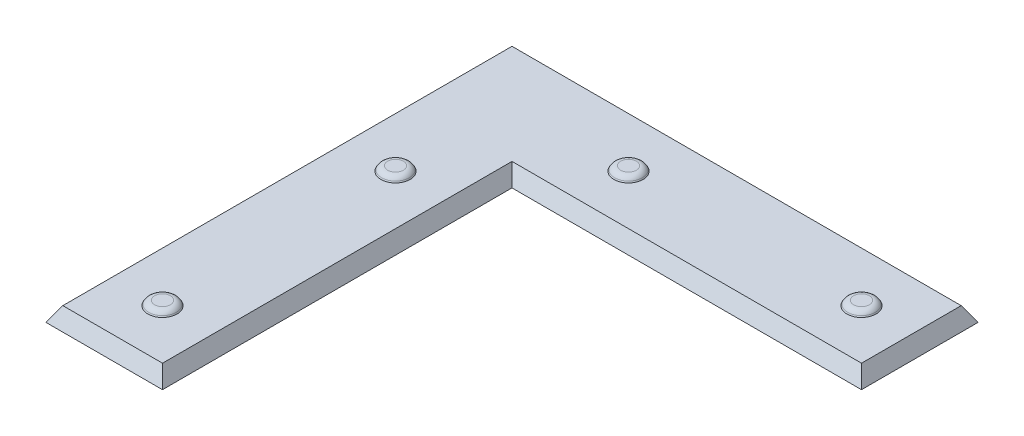
from build123d import *

# Parameters (mm, degrees)
BOSS_EXTRUDE1_DEPTH           = 0.79375
BOSS_EXTRUDE1_TAPER           = 30
SKETCH3_R                     = 0.79375
BOSS_EXTRUDE2_DEPTH           = 0.254
BOSS_EXTRUDE2_DRAFT           = 30
BOSS_EXTRUDE2_PROFILE_2_DEPTH = 0.254
BOSS_EXTRUDE2_PROFILE_2_DRAFT = 30
BOSS_EXTRUDE2_PROFILE_3_DEPTH = 0.254
BOSS_EXTRUDE2_PROFILE_3_DRAFT = 30
BOSS_EXTRUDE2_PROFILE_4_DEPTH = 0.254
BOSS_EXTRUDE2_PROFILE_4_DRAFT = 30
FILLET1_R                     = 0.381


with BuildPart() as part:
    # Sketch2 → Boss-Extrude1 (new body)
    with BuildSketch(Plane(origin=(0, 15.875, 0), x_dir=(1, 0, 0), z_dir=(0, 1, 0))):
        Polygon((-169.8625, 61.9125), (-163.5125, 61.9125), (-163.5125, 80.9625), (-144.4625, 80.9625), (-144.4625, 87.3125), (-169.8625, 87.3125), align=None)
    extrude(amount=BOSS_EXTRUDE1_DEPTH, taper=BOSS_EXTRUDE1_TAPER)


with BuildPart() as boss_extrude2_tool:
    # Sketch3 → Boss-Extrude2 (with draft: the straight prism first)
    with BuildSketch(Plane(origin=(0, 16.66875, 0), x_dir=(1, 0, 0), z_dir=(0, 1, 0))):
        with Locations((-166.6875, 65.0875)):
            Circle(SKETCH3_R)
    extrude(amount=BOSS_EXTRUDE2_DEPTH)
    # Boss-Extrude2: the draft: its side faces are tilted about the plane it starts from
    boss_extrude2_sides = [boss_extrude2_tool.faces().sort_by_distance(p)[0] for p in [
        (-167.48125, 16.79575, -65.0875),
    ]]
    draft(boss_extrude2_sides, Plane(origin=(0, 16.66875, 0), x_dir=(1, 0, 0), z_dir=(0, 1, 0)), BOSS_EXTRUDE2_DRAFT)


with BuildPart() as part_1:
    add(part.part)

    # Boss-Extrude2: add boss_extrude2_tool
    add(boss_extrude2_tool.part)


with BuildPart() as boss_extrude2_profile_2_tool:
    # Sketch3 → Boss-Extrude2 profile 2 (with draft: the straight prism first)
    with BuildSketch(Plane(origin=(0, 16.66875, 0), x_dir=(1, 0, 0), z_dir=(0, 1, 0))):
        with Locations((-166.6875, 77.7875)):
            Circle(SKETCH3_R)
    extrude(amount=BOSS_EXTRUDE2_PROFILE_2_DEPTH)
    # Boss-Extrude2 profile 2: the draft: its side faces are tilted about the plane it starts from
    boss_extrude2_profile_2_sides = [boss_extrude2_profile_2_tool.faces().sort_by_distance(p)[0] for p in [
        (-167.48125, 16.79575, -77.7875),
    ]]
    draft(boss_extrude2_profile_2_sides, Plane(origin=(0, 16.66875, 0), x_dir=(1, 0, 0), z_dir=(0, 1, 0)), BOSS_EXTRUDE2_PROFILE_2_DRAFT)


with BuildPart() as part_2:
    add(part_1.part)

    # Boss-Extrude2 profile 2: add boss_extrude2_profile_2_tool
    add(boss_extrude2_profile_2_tool.part)


with BuildPart() as boss_extrude2_profile_3_tool:
    # Sketch3 → Boss-Extrude2 profile 3 (with draft: the straight prism first)
    with BuildSketch(Plane(origin=(0, 16.66875, 0), x_dir=(1, 0, 0), z_dir=(0, 1, 0))):
        with Locations((-160.3375, 84.1375)):
            Circle(SKETCH3_R)
    extrude(amount=BOSS_EXTRUDE2_PROFILE_3_DEPTH)
    # Boss-Extrude2 profile 3: the draft: its side faces are tilted about the plane it starts from
    boss_extrude2_profile_3_sides = [boss_extrude2_profile_3_tool.faces().sort_by_distance(p)[0] for p in [
        (-161.13125, 16.79575, -84.1375),
    ]]
    draft(boss_extrude2_profile_3_sides, Plane(origin=(0, 16.66875, 0), x_dir=(1, 0, 0), z_dir=(0, 1, 0)), BOSS_EXTRUDE2_PROFILE_3_DRAFT)


with BuildPart() as part_3:
    add(part_2.part)

    # Boss-Extrude2 profile 3: add boss_extrude2_profile_3_tool
    add(boss_extrude2_profile_3_tool.part)


with BuildPart() as boss_extrude2_profile_4_tool:
    # Sketch3 → Boss-Extrude2 profile 4 (with draft: the straight prism first)
    with BuildSketch(Plane(origin=(0, 16.66875, 0), x_dir=(1, 0, 0), z_dir=(0, 1, 0))):
        with Locations((-147.6375, 84.1375)):
            Circle(SKETCH3_R)
    extrude(amount=BOSS_EXTRUDE2_PROFILE_4_DEPTH)
    # Boss-Extrude2 profile 4: the draft: its side faces are tilted about the plane it starts from
    boss_extrude2_profile_4_sides = [boss_extrude2_profile_4_tool.faces().sort_by_distance(p)[0] for p in [
        (-148.43125, 16.79575, -84.1375),
    ]]
    draft(boss_extrude2_profile_4_sides, Plane(origin=(0, 16.66875, 0), x_dir=(1, 0, 0), z_dir=(0, 1, 0)), BOSS_EXTRUDE2_PROFILE_4_DRAFT)


with BuildPart() as part_4:
    add(part_3.part)

    # Boss-Extrude2 profile 4: add boss_extrude2_profile_4_tool
    add(boss_extrude2_profile_4_tool.part)

    # Fillet1
    fillet1_edges = [part_4.edges().sort_by_distance(p)[0] for p in [
        (-167.334603032, 16.92275, -65.0875),
        (-167.334603032, 16.92275, -77.7875),
        (-160.984603032, 16.92275, -84.1375),
        (-148.284603032, 16.92275, -84.1375),
    ]]
    fillet(fillet1_edges, radius=FILLET1_R)


solid = part_4.part
